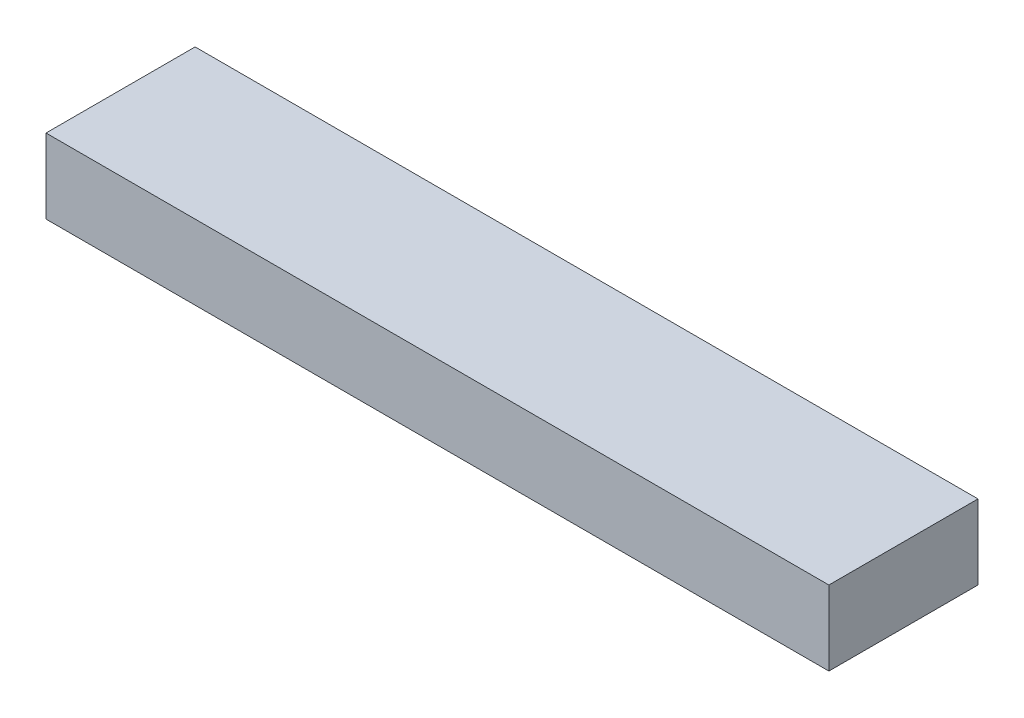
from build123d import *

# Parameters (mm, degrees)
ESQUISSE1_W        = 1.05
ESQUISSE1_H        = 0.2
BOSS_EXTRU_1_DEPTH = 0.1


with BuildPart() as part:
    # Esquisse1 → Boss.-Extru.1 (new body)
    with BuildSketch(Plane(origin=(0, 0, 0), x_dir=(1, 0, 0), z_dir=(0, 1, 0))):
        Rectangle(ESQUISSE1_W, ESQUISSE1_H)
    extrude(amount=BOSS_EXTRU_1_DEPTH)


solid = part.part
